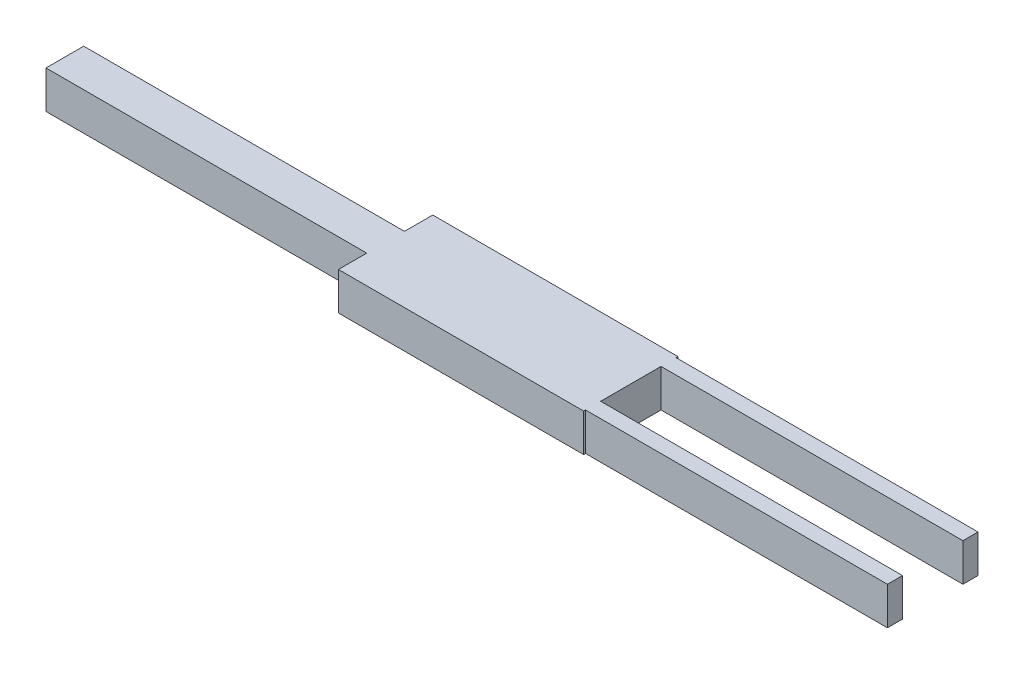
from build123d import *

# Parameters (mm, degrees)
BOSS_EXTRUDE1_DEPTH = 10


with BuildPart() as part:
    # Sketch1 → Boss-Extrude1 (new body)
    with BuildSketch(Plane(origin=(0, 0, 0), x_dir=(1, 0, 0), z_dir=(0, 1, 0))):
        Polygon((251.197875898, 10.186414256), (171.197875898, 10.186414256), (171.197875898, -5.813585744), (251.197875898, -5.813585744), (251.197875898, -9.813585744), (171.197875898, -9.813585744), (171.197875898, -10.313585744), (106.197875898, -10.313585744), (106.197875898, -2.813585744), (21.197875898, -2.813585744), (21.197875898, 7.186414256), (106.197875898, 7.186414256), (106.197875898, 14.686414256), (171.197875898, 14.686414256), (171.197875898, 14.186414256), (251.197875898, 14.186414256), align=None)
    extrude(amount=BOSS_EXTRUDE1_DEPTH)


solid = part.part
